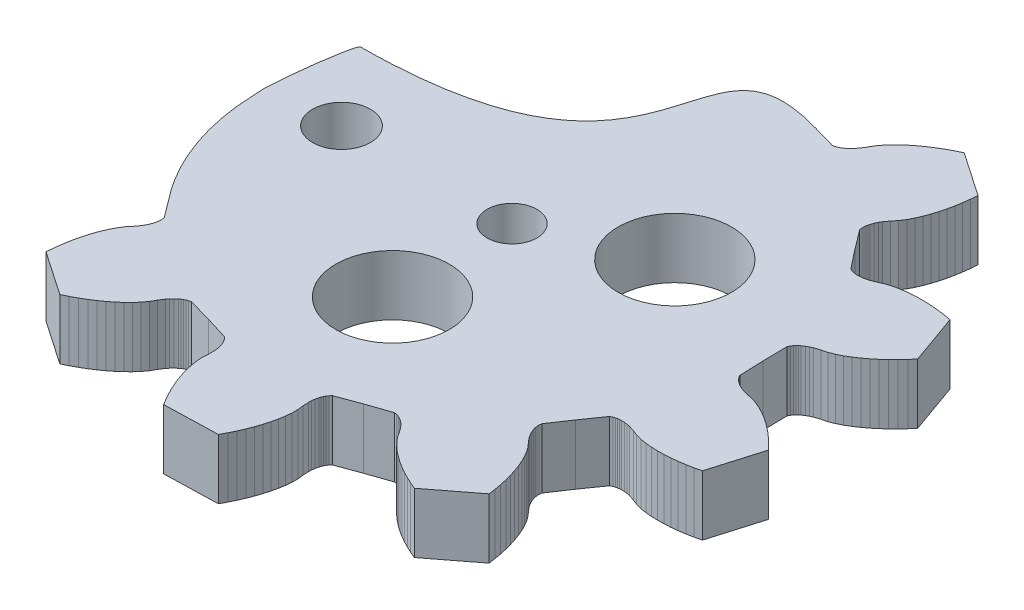
from build123d import *

# Parameters (mm, degrees)
SKETCH1_R           = 1.529953047
SKETCH1_R_2         = 1.3158
SKETCH1_R_3         = 2.999239789
SKETCH1_R_4         = 2.999854102
BOSS_EXTRUDE1_DEPTH = 3.175


with BuildPart() as part:
    # Sketch1 → Boss-Extrude1 (new body)
    with BuildSketch(Plane(origin=(0, 0, 0), x_dir=(1, 0, 0), z_dir=(0, 1, 0))):
        with BuildLine():
            Line((145.872160584, 51.241037226), (145.849760584, 52.524037226))
            Line((145.849760584, 52.524037226), (145.910860584, 52.645137226))
            Line((145.910860584, 52.645137226), (145.975360584, 52.736337226))
            Line((145.975360584, 52.736337226), (146.041860584, 52.811437226))
            Line((146.041860584, 52.811437226), (146.109660584, 52.875737226))
            Line((146.109660584, 52.875737226), (146.178360584, 52.932037226))
            Line((146.178360584, 52.932037226), (146.318260584, 53.027237226))
            Line((146.318260584, 53.027237226), (146.460660584, 53.104837226))
            Line((146.460660584, 53.104837226), (146.605060584, 53.168937226))
            Line((146.605060584, 53.168937226), (146.899060584, 53.265837226))
            Line((146.899060584, 53.265837226), (147.196360584, 53.342137226))
            Line((147.196360584, 53.342137226), (147.486860584, 53.456837226))
            Line((147.486860584, 53.456837226), (147.772060584, 53.599637226))
            Line((147.772060584, 53.599637226), (148.052360584, 53.765237226))
            Line((148.052360584, 53.765237226), (148.327960584, 53.950637226))
            Line((148.327960584, 53.950637226), (148.598660584, 54.154137226))
            Line((148.598660584, 54.154137226), (148.864360584, 54.374437226))
            Line((148.864360584, 54.374437226), (149.124760584, 54.611037226))
            Line((149.124760584, 54.611037226), (149.379560584, 54.862737226))
            Line((149.379560584, 54.862737226), (149.628660584, 55.129437226))
            Line((149.628660584, 55.129437226), (149.871460584, 55.410437226))
            Line((149.871460584, 55.410437226), (148.927660584, 58.063237226))
            Line((148.927660584, 58.063237226), (148.561960584, 58.127537226))
            Line((148.561960584, 58.127537226), (148.200360584, 58.176937226))
            Line((148.200360584, 58.176937226), (147.843760584, 58.211237226))
            Line((147.843760584, 58.211237226), (147.492460584, 58.230037226))
            Line((147.492460584, 58.230037226), (147.147260584, 58.232937226))
            Line((147.147260584, 58.232937226), (146.808960584, 58.219637226))
            Line((146.808960584, 58.219637226), (146.478160584, 58.189237226))
            Line((146.478160584, 58.189237226), (146.156260584, 58.140637226))
            Line((146.156260584, 58.140637226), (145.844860584, 58.071337226))
            Line((145.844860584, 58.071337226), (145.547360584, 57.976837226))
            Line((145.547360584, 57.976837226), (145.268560584, 57.848037226))
            Line((145.268560584, 57.848037226), (144.979460584, 57.737537226))
            Line((144.979460584, 57.737537226), (144.826960584, 57.695937226))
            Line((144.826960584, 57.695937226), (144.667560584, 57.666137226))
            Line((144.667560584, 57.666137226), (144.499060584, 57.651637226))
            Line((144.499060584, 57.651637226), (144.410160584, 57.651937226))
            Line((144.410160584, 57.651937226), (144.317060584, 57.658937226))
            Line((144.317060584, 57.658937226), (144.218160584, 57.675237226))
            Line((144.218160584, 57.675237226), (144.110460584, 57.705037226))
            Line((144.110460584, 57.705037226), (143.986560584, 57.760337226))
            Line((143.986560584, 57.760337226), (143.193460584, 58.769137226))
            Line((143.193460584, 58.769137226), (142.421060584, 59.794037226))
            Line((142.421060584, 59.794037226), (142.399460584, 59.928137226))
            Line((142.399460584, 59.928137226), (142.398060584, 60.039737226))
            Line((142.398060584, 60.039737226), (142.407760584, 60.139537226))
            Line((142.407760584, 60.139537226), (142.424660584, 60.231237226))
            Line((142.424660584, 60.231237226), (142.447260584, 60.317337226))
            Line((142.447260584, 60.317337226), (142.504360584, 60.476537226))
            Line((142.504360584, 60.476537226), (142.574060584, 60.623037226))
            Line((142.574060584, 60.623037226), (142.653160584, 60.759737226))
            Line((142.653160584, 60.759737226), (142.834160584, 61.010937226))
            Line((142.834160584, 61.010937226), (143.029760584, 61.247437226))
            Line((143.029760584, 61.247437226), (143.197460584, 61.511037226))
            Line((143.197460584, 61.511037226), (143.344060584, 61.794237226))
            Line((143.344060584, 61.794237226), (143.473460584, 62.092937226))
            Line((143.473460584, 62.092937226), (143.587360584, 62.404937226))
            Line((143.587360584, 62.404937226), (143.686860584, 62.728637226))
            Line((143.686860584, 62.728637226), (143.772360584, 63.063137226))
            Line((143.772360584, 63.063137226), (143.844060584, 63.407537226))
            Line((143.844060584, 63.407537226), (143.902160584, 63.760937226))
            Line((143.902160584, 63.760937226), (143.946960584, 64.123137226))
            Line((143.946960584, 64.123137226), (143.978260584, 64.493137226))
            Line((143.978260584, 64.493137226), (141.655460584, 66.084437226))
            Line((141.655460584, 66.084437226), (141.321660584, 65.921637226))
            Line((141.321660584, 65.921637226), (141.000160584, 65.749037226))
            Line((141.000160584, 65.749037226), (140.691560584, 65.567137226))
            Line((140.691560584, 65.567137226), (140.396360584, 65.375837226))
            Line((140.396360584, 65.375837226), (140.115260584, 65.175437226))
            Line((140.115260584, 65.175437226), (139.849260584, 64.965837226))
            Line((139.849260584, 64.965837226), (139.599560584, 64.746837226))
            Line((139.599560584, 64.746837226), (139.367860584, 64.518237226))
            Line((139.367860584, 64.518237226), (139.156660584, 64.279037226))
            Line((139.156660584, 64.279037226), (138.971360584, 64.027637226))
            Line((138.971360584, 64.027637226), (138.821560584, 63.759737226))
            Line((138.821560584, 63.759737226), (138.652760584, 63.500337226))
            Line((138.652760584, 63.500337226), (138.553760584, 63.377137226))
            Line((138.553760584, 63.377137226), (138.442360584, 63.259337226))
            Line((138.442360584, 63.259337226), (138.314360584, 63.148537226))
            Line((138.314360584, 63.148537226), (138.242360584, 63.096437226))
            Line((138.242360584, 63.096437226), (138.162960584, 63.047437226))
            Line((138.162960584, 63.047437226), (138.073360584, 63.002337226))
            Line((138.073360584, 63.002337226), (137.968860584, 62.963237226))
            Line((137.968860584, 62.963237226), (137.836060584, 62.935137226))
            Line((137.836060584, 62.935137226), (136.601360584, 63.285237226))
            add(Edge.make_bspline(
                [(136.601360584, 63.285237226), (128.192860584, 65.715037226), (137.250160584, 55.035237226), (120.847960584, 54.969437226)],
                knots=[0.326996198, 0.326996198, 0.326996198, 0.326996198, 0.330798479, 0.330798479, 0.330798479, 0.330798479], degree=3))
            add(Edge.make_bspline(
                [(120.847960584, 54.969437226), (120.670560584, 54.950637226), (120.270960584, 52.255037226), (120.203060584, 50.524437226)],
                knots=[0.330798479, 0.330798479, 0.330798479, 0.330798479, 0.33460076, 0.33460076, 0.33460076, 0.33460076], degree=3))
            Line((120.203060584, 50.524437226), (120.239060584, 49.853137226))
            add(Edge.make_bspline(
                [(120.239060584, 49.853137226), (120.382460584, 46.303337226), (121.945760584, 43.960737226), (122.702560584, 42.996837226)],
                knots=[0.338403042, 0.338403042, 0.338403042, 0.338403042, 0.342205323, 0.342205323, 0.342205323, 0.342205323], degree=3))
            Line((122.702560584, 42.996837226), (123.474960584, 41.971937226))
            Line((123.474960584, 41.971937226), (123.496660584, 41.837937226))
            Line((123.496660584, 41.837937226), (123.497960584, 41.726237226))
            Line((123.497960584, 41.726237226), (123.488460584, 41.626537226))
            Line((123.488460584, 41.626537226), (123.471260584, 41.534737226))
            Line((123.471260584, 41.534737226), (123.448760584, 41.448637226))
            Line((123.448760584, 41.448637226), (123.391660584, 41.289537226))
            Line((123.391660584, 41.289537226), (123.321960584, 41.142937226))
            Line((123.321960584, 41.142937226), (123.242860584, 41.006137226))
            Line((123.242860584, 41.006137226), (123.062060584, 40.755037226))
            Line((123.062060584, 40.755037226), (122.866360584, 40.518537226))
            Line((122.866360584, 40.518537226), (122.698660584, 40.255037226))
            Line((122.698660584, 40.255037226), (122.552060584, 39.971737226))
            Line((122.552060584, 39.971737226), (122.422560584, 39.673037226))
            Line((122.422560584, 39.673037226), (122.308560584, 39.361137226))
            Line((122.308560584, 39.361137226), (122.209160584, 39.037337226))
            Line((122.209160584, 39.037337226), (122.123760584, 38.702937226))
            Line((122.123760584, 38.702937226), (122.052060584, 38.358537226))
            Line((122.052060584, 38.358537226), (121.993860584, 38.004937226))
            Line((121.993860584, 38.004937226), (121.949160584, 37.642937226))
            Line((121.949160584, 37.642937226), (121.917760584, 37.272837226))
            Line((121.917760584, 37.272837226), (124.240660584, 35.681537226))
            Line((124.240660584, 35.681537226), (124.574460584, 35.844437226))
            Line((124.574460584, 35.844437226), (124.895960584, 36.017037226))
            Line((124.895960584, 36.017037226), (125.204560584, 36.198937226))
            Line((125.204560584, 36.198937226), (125.499760584, 36.390037226))
            Line((125.499760584, 36.390037226), (125.780860584, 36.590537226))
            Line((125.780860584, 36.590537226), (126.046760584, 36.800137226))
            Line((126.046760584, 36.800137226), (126.296460584, 37.019137226))
            Line((126.296460584, 37.019137226), (126.528160584, 37.247837226))
            Line((126.528160584, 37.247837226), (126.739460584, 37.486737226))
            Line((126.739460584, 37.486737226), (126.924560584, 37.738437226))
            Line((126.924560584, 37.738437226), (127.074560584, 38.006337226))
            Line((127.074560584, 38.006337226), (127.243360584, 38.265637226))
            Line((127.243360584, 38.265637226), (127.342260584, 38.388937226))
            Line((127.342260584, 38.388937226), (127.453760584, 38.506637226))
            Line((127.453760584, 38.506637226), (127.581560584, 38.617537226))
            Line((127.581560584, 38.617537226), (127.653660584, 38.669537226))
            Line((127.653660584, 38.669537226), (127.733160584, 38.718637226))
            Line((127.733160584, 38.718637226), (127.822660584, 38.763637226))
            Line((127.822660584, 38.763637226), (127.927260584, 38.802637226))
            Line((127.927260584, 38.802637226), (128.059960584, 38.830937226))
            Line((128.059960584, 38.830937226), (129.294660584, 38.480837226))
            Line((129.294660584, 38.480837226), (130.522060584, 38.105537226))
            Line((130.522060584, 38.105537226), (130.618260584, 38.010037226))
            Line((130.618260584, 38.010037226), (130.685060584, 37.920437226))
            Line((130.685060584, 37.920437226), (130.735860584, 37.834037226))
            Line((130.735860584, 37.834037226), (130.776060584, 37.749837226))
            Line((130.776060584, 37.749837226), (130.808460584, 37.666937226))
            Line((130.808460584, 37.666937226), (130.855660584, 37.504637226))
            Line((130.855660584, 37.504637226), (130.885460584, 37.345037226))
            Line((130.885460584, 37.345037226), (130.901760584, 37.187937226))
            Line((130.901760584, 37.187937226), (130.903060584, 36.878537226))
            Line((130.903060584, 36.878537226), (130.883860584, 36.572137226))
            Line((130.883860584, 36.572137226), (130.902960584, 36.260437226))
            Line((130.902960584, 36.260437226), (130.950960584, 35.944937226))
            Line((130.950960584, 35.944937226), (131.021760584, 35.627237226))
            Line((131.021760584, 35.627237226), (131.112860584, 35.307937226))
            Line((131.112860584, 35.307937226), (131.222760584, 34.987537226))
            Line((131.222760584, 34.987537226), (131.350260584, 34.666737226))
            Line((131.350260584, 34.666737226), (131.494660584, 34.345937226))
            Line((131.494660584, 34.345937226), (131.655360584, 34.025737226))
            Line((131.655360584, 34.025737226), (131.832060584, 33.706537226))
            Line((131.832060584, 33.706537226), (132.024160584, 33.388637226))
            Line((132.024160584, 33.388637226), (134.838760584, 33.466637226))
            Line((134.838760584, 33.466637226), (135.013060584, 33.794637226))
            Line((135.013060584, 33.794637226), (135.171660584, 34.123137226))
            Line((135.171660584, 34.123137226), (135.314460584, 34.451837226))
            Line((135.314460584, 34.451837226), (135.440960584, 34.780037226))
            Line((135.440960584, 34.780037226), (135.550560584, 35.107337226))
            Line((135.550560584, 35.107337226), (135.642460584, 35.433337226))
            Line((135.642460584, 35.433337226), (135.715660584, 35.757237226))
            Line((135.715660584, 35.757237226), (135.768960584, 36.078437226))
            Line((135.768960584, 36.078437226), (135.799260584, 36.395937226))
            Line((135.799260584, 36.395937226), (135.801260584, 36.708337226))
            Line((135.801260584, 36.708337226), (135.764960584, 37.013137226))
            Line((135.764960584, 37.013137226), (135.749260584, 37.322237226))
            Line((135.749260584, 37.322237226), (135.756760584, 37.480137226))
            Line((135.756760584, 37.480137226), (135.777760584, 37.640837226))
            Line((135.777760584, 37.640837226), (135.815860584, 37.805737226))
            Line((135.815860584, 37.805737226), (135.843660584, 37.890137226))
            Line((135.843660584, 37.890137226), (135.879160584, 37.976537226))
            Line((135.879160584, 37.976537226), (135.925060584, 38.065637226))
            Line((135.925060584, 38.065637226), (135.986760584, 38.158637226))
            Line((135.986760584, 38.158637226), (136.077660584, 38.259537226))
            Line((136.077660584, 38.259537226), (137.282260584, 38.701937226))
            Line((137.282260584, 38.701937226), (138.495560584, 39.119837226))
            Line((138.495560584, 39.119837226), (138.629660584, 39.099037226))
            Line((138.629660584, 39.099037226), (138.736360584, 39.065937226))
            Line((138.736360584, 39.065937226), (138.828260584, 39.025937226))
            Line((138.828260584, 39.025937226), (138.910260584, 38.981337226))
            Line((138.910260584, 38.981337226), (138.985160584, 38.933437226))
            Line((138.985160584, 38.933437226), (139.118960584, 38.829737226))
            Line((139.118960584, 38.829737226), (139.236660584, 38.718237226))
            Line((139.236660584, 38.718237226), (139.342260584, 38.600637226))
            Line((139.342260584, 38.600637226), (139.525260584, 38.351237226))
            Line((139.525260584, 38.351237226), (139.689660584, 38.092037226))
            Line((139.689660584, 38.092037226), (139.888560584, 37.851037226))
            Line((139.888560584, 37.851037226), (140.112660584, 37.624037226))
            Line((140.112660584, 37.624037226), (140.356760584, 37.408637226))
            Line((140.356760584, 37.408637226), (140.618160584, 37.203837226))
            Line((140.618160584, 37.203837226), (140.895360584, 37.009237226))
            Line((140.895360584, 37.009237226), (141.187160584, 36.824637226))
            Line((141.187160584, 36.824637226), (141.492460584, 36.650037226))
            Line((141.492460584, 36.650037226), (141.810660584, 36.485437226))
            Line((141.810660584, 36.485437226), (142.141160584, 36.330937226))
            Line((142.141160584, 36.330937226), (142.483460584, 36.186737226))
            Line((142.483460584, 36.186737226), (144.714660584, 37.904237226))
            Line((144.714660584, 37.904237226), (144.662860584, 38.272037226))
            Line((144.662860584, 38.272037226), (144.598160584, 38.631037226))
            Line((144.598160584, 38.631037226), (144.520560584, 38.980837226))
            Line((144.520560584, 38.980837226), (144.429960584, 39.320737226))
            Line((144.429960584, 39.320737226), (144.326060584, 39.649937226))
            Line((144.326060584, 39.649937226), (144.208860584, 39.967737226))
            Line((144.208860584, 39.967737226), (144.077860584, 40.272937226))
            Line((144.077860584, 40.272937226), (143.932060584, 40.563837226))
            Line((143.932060584, 40.563837226), (143.769960584, 40.838637226))
            Line((143.769960584, 40.838637226), (143.587960584, 41.092437226))
            Line((143.587960584, 41.092437226), (143.379460584, 41.317737226))
            Line((143.379460584, 41.317737226), (143.184860584, 41.558637226))
            Line((143.184860584, 41.558637226), (143.098360584, 41.690637226))
            Line((143.098360584, 41.690637226), (143.020760584, 41.833137226))
            Line((143.020760584, 41.833137226), (142.954860584, 41.988937226))
            Line((142.954860584, 41.988937226), (142.927560584, 42.073537226))
            Line((142.927560584, 42.073537226), (142.905560584, 42.164237226))
            Line((142.905560584, 42.164237226), (142.890460584, 42.263337226))
            Line((142.890460584, 42.263337226), (142.885560584, 42.374837226))
            Line((142.885560584, 42.374837226), (142.899760584, 42.509837226))
            Line((142.899760584, 42.509837226), (143.614260584, 43.575937226))
            Line((143.614260584, 43.575937226), (144.350260584, 44.627237226))
            Line((144.350260584, 44.627237226), (144.471060584, 44.689237226))
            Line((144.471060584, 44.689237226), (144.576760584, 44.724937226))
            Line((144.576760584, 44.724937226), (144.674760584, 44.746637226))
            Line((144.674760584, 44.746637226), (144.767260584, 44.758837226))
            Line((144.767260584, 44.758837226), (144.855960584, 44.764037226))
            Line((144.855960584, 44.764037226), (145.025060584, 44.758837226))
            Line((145.025060584, 44.758837226), (145.185860584, 44.737937226))
            Line((145.185860584, 44.737937226), (145.340460584, 44.704837226))
            Line((145.340460584, 44.704837226), (145.635160584, 44.610537226))
            Line((145.635160584, 44.610537226), (145.920660584, 44.497537226))
            Line((145.920660584, 44.497537226), (146.223060584, 44.419337226))
            Line((146.223060584, 44.419337226), (146.537860584, 44.367637226))
            Line((146.537860584, 44.367637226), (146.861960584, 44.336737226))
            Line((146.861960584, 44.336737226), (147.193660584, 44.324737226))
            Line((147.193660584, 44.324737226), (147.532360584, 44.330137226))
            Line((147.532360584, 44.330137226), (147.876860584, 44.352237226))
            Line((147.876860584, 44.352237226), (148.226560584, 44.390637226))
            Line((148.226560584, 44.390637226), (148.580860584, 44.444437226))
            Line((148.580860584, 44.444437226), (148.938960584, 44.513737226))
            Line((148.938960584, 44.513737226), (149.300560584, 44.598237226))
            Line((149.300560584, 44.598237226), (150.096160584, 47.299337226))
            Line((150.096160584, 47.299337226), (149.838160584, 47.566237226))
            Line((149.838160584, 47.566237226), (149.574660584, 47.818737226))
            Line((149.574660584, 47.818737226), (149.306360584, 48.056237226))
            Line((149.306360584, 48.056237226), (149.033160584, 48.277837226))
            Line((149.033160584, 48.277837226), (148.755660584, 48.483037226))
            Line((148.755660584, 48.483037226), (148.474060584, 48.671237226))
            Line((148.474060584, 48.671237226), (148.188660584, 48.841137226))
            Line((148.188660584, 48.841137226), (147.899760584, 48.990937226))
            Line((147.899760584, 48.990937226), (147.607060584, 49.117937226))
            Line((147.607060584, 49.117937226), (147.310560584, 49.216337226))
            Line((147.310560584, 49.216337226), (147.009560584, 49.276037226))
            Line((147.009560584, 49.276037226), (146.710760584, 49.356537226))
            Line((146.710760584, 49.356537226), (146.562960584, 49.412437226))
            Line((146.562960584, 49.412437226), (146.416360584, 49.482137226))
            Line((146.416360584, 49.482137226), (146.271560584, 49.569437226))
            Line((146.271560584, 49.569437226), (146.199660584, 49.621937226))
            Line((146.199660584, 49.621937226), (146.128560584, 49.682337226))
            Line((146.128560584, 49.682337226), (146.058060584, 49.753537226))
            Line((146.058060584, 49.753537226), (145.988560584, 49.841137226))
            Line((145.988560584, 49.841137226), (145.920760584, 49.958537226))
            Line((145.920760584, 49.958537226), (145.872160584, 51.241037226))
        make_face()
        with Locations(Location((123.964210584, 50.852487226, 0), (0, 0, 270))):
            Circle(SKETCH1_R, mode=Mode.SUBTRACT)
        with Locations(Location((132.948060584, 50.883037226, 0), (0, 0, 270))):
            Circle(SKETCH1_R_2, mode=Mode.SUBTRACT)
        with Locations(Location((138.900810584, 53.540437226, 0), (0, 0, 270))):
            Circle(SKETCH1_R_3, mode=Mode.SUBTRACT)
        with Locations(Location((133.141110584, 44.373337226, 0), (0, 0, 270))):
            Circle(SKETCH1_R_4, mode=Mode.SUBTRACT)
    extrude(amount=BOSS_EXTRUDE1_DEPTH)


solid = part.part
